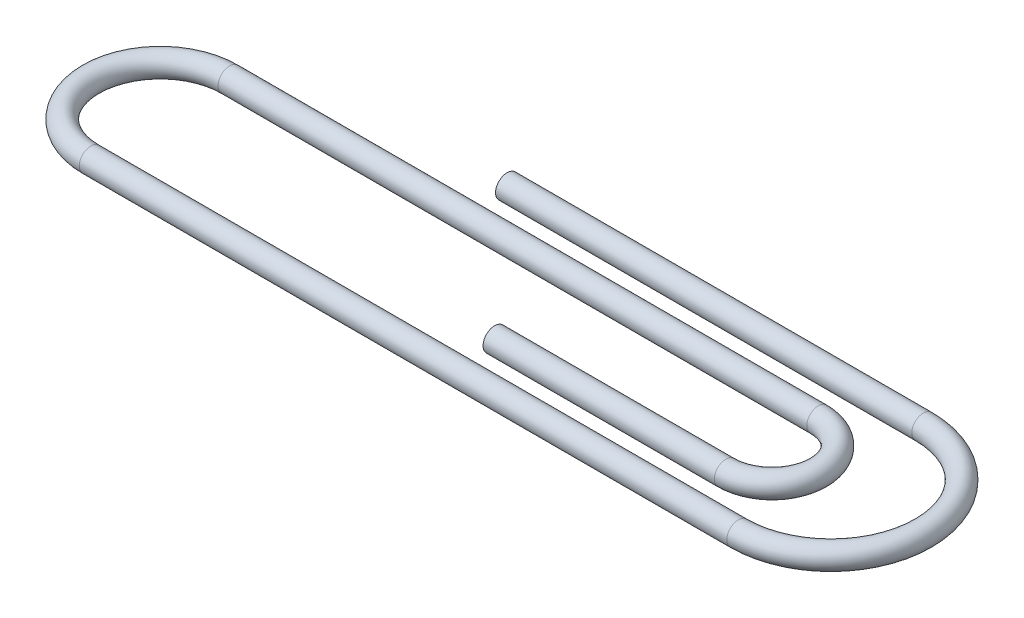
from build123d import *

# Parameters (mm, degrees)
SWEEP4_PROFILE_R = 0.5


with BuildPart() as part:
    # Sweep4: sweep along a path in Sketch1
    with BuildLine(Plane(origin=(0, 0, 0), x_dir=(1, 0, 0), z_dir=(0, 1, 0))) as sweep4_path:
        Line((0, 0), (18, 0))
        ThreePointArc((18, 0), (22, -4), (18, -8))
        Line((18, -8), (-10, -8))
        ThreePointArc((-10, -8), (-13, -5), (-10, -2))
        Line((-10, -2), (15.460327364, -2))
        ThreePointArc((15.460327364, -2), (17.460327364, -4), (15.460327364, -6))
        Line((15.460327364, -6), (5.460327364, -6))
    # Sweep4 profile (on start of the path) → Sweep4 (sweep)
    with BuildSketch(Plane(origin=(0, 0, 0), x_dir=(0, 0, 1), z_dir=(1, 0, 0))):
        Circle(SWEEP4_PROFILE_R)
    sweep(path=sweep4_path.line)


solid = part.part
